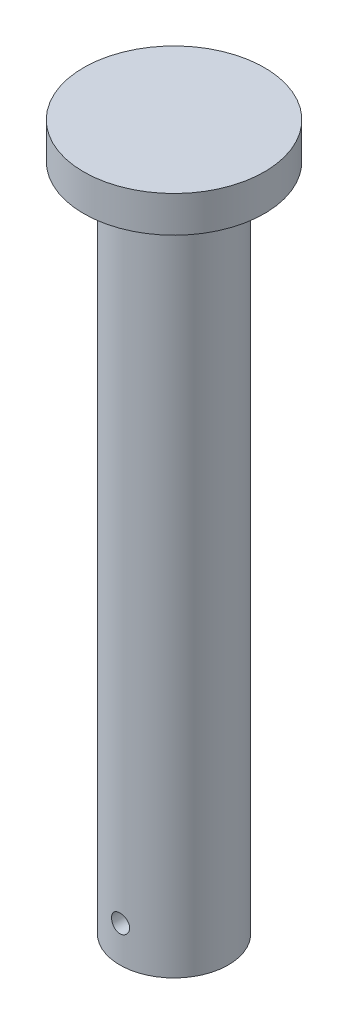
from build123d import *

# Parameters (mm, degrees)
SKETCH1_R           = 25
BOSS_EXTRUDE1_DEPTH = 5
SKETCH2_R           = 15
BOSS_EXTRUDE2_DEPTH = 185
SKETCH3_R           = 2.5
CUT_EXTRUDE2_DEPTH  = 25


with BuildPart() as part:
    # Sketch1 → Boss-Extrude1 (new, symmetric)
    with BuildSketch(Plane(origin=(0, 0, 0), x_dir=(1, 0, 0), z_dir=(0, 1, 0))):
        with Locations(Location((0, 0, 0), (0, 0, 270))):
            Circle(SKETCH1_R)
    extrude(amount=BOSS_EXTRUDE1_DEPTH, both=True)

    # Sketch2 → Boss-Extrude2 (add)
    with BuildSketch(Plane.XZ.offset(5)):
        with Locations(Location((0, 0, 0), (0, 0, 270))):
            Circle(SKETCH2_R)
    extrude(amount=BOSS_EXTRUDE2_DEPTH)

    # Sketch3 → Cut-Extrude2 (cut, symmetric)
    with BuildSketch(Plane.XY):
        with Locations(Location((0, -180, 0), (0, 0, 270.000000023))):
            Circle(SKETCH3_R)
    extrude(amount=CUT_EXTRUDE2_DEPTH, both=True, mode=Mode.SUBTRACT)


solid = part.part
